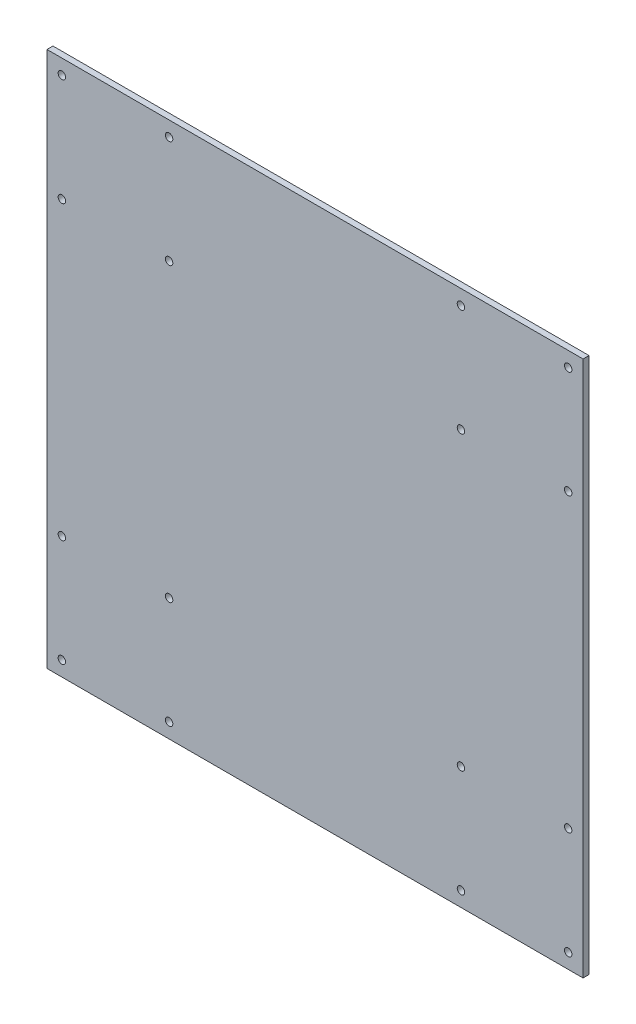
from build123d import *

# Parameters (mm, degrees)
SKETCH_1_W        = 180
SKETCH_1_H        = 180
EXTRUDE_1_DEPTH   = 2
M3X0_5_1_D        = 2.5
MIRROR_2_COPY_1_D = 2.5


with BuildPart() as part:
    # ｽｹｯﾁ1 → ﾎﾞｽ - 押し出し1 (new body)
    with BuildSketch(Plane.XY):
        with Locations((90, 90)):
            Rectangle(SKETCH_1_W, SKETCH_1_H)
    extrude(amount=EXTRUDE_1_DEPTH)

    # M3x0.5 ねじ穴1 (through all)
    with Locations(Plane.XY.offset(2)):
        with Locations((175, 5), (175, 41), (139, 41), (139, 5)):
            m3x0_5_1 = Hole(M3X0_5_1_D / 2)

    # ﾐﾗｰ1: M3x0.5 ねじ穴1 across plane
    add(m3x0_5_1.mirror(Plane.ZX.offset(90)), mode=Mode.SUBTRACT)

    # ﾐﾗｰ2: M3x0.5 ねじ穴1 across plane
    add(m3x0_5_1.mirror(Plane(origin=(90, 0, 0), x_dir=(0, 0, 1), z_dir=(1, 0, 0))), mode=Mode.SUBTRACT)

    # ﾐﾗｰ2 copy 1 (through all)
    with Locations(Plane(origin=(180, 180, 2), x_dir=(-1, 0, 0), z_dir=(0, 0, 1))):
        with Locations((175, 5), (175, 41), (139, 41), (139, 5)):
            Hole(MIRROR_2_COPY_1_D / 2)


solid = part.part
